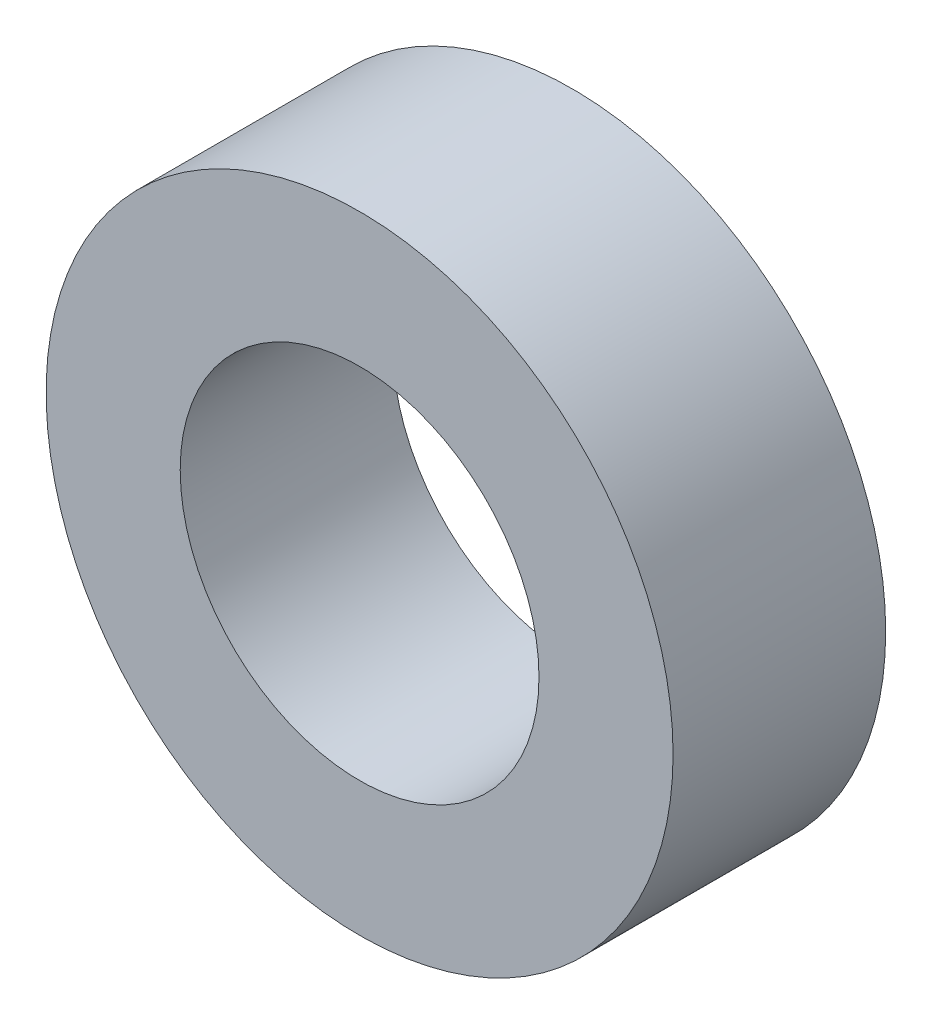
from build123d import *

# Parameters (mm, degrees)
SKETCH1_R           = 23.59
SKETCH1_R_2         = 13.5
BOSS_EXTRUDE1_DEPTH = 16


with BuildPart() as part:
    # Sketch1 → Boss-Extrude1 (new body)
    with BuildSketch(Plane.XY):
        Circle(SKETCH1_R)
        Circle(SKETCH1_R_2, mode=Mode.SUBTRACT)
    extrude(amount=BOSS_EXTRUDE1_DEPTH)


solid = part.part
